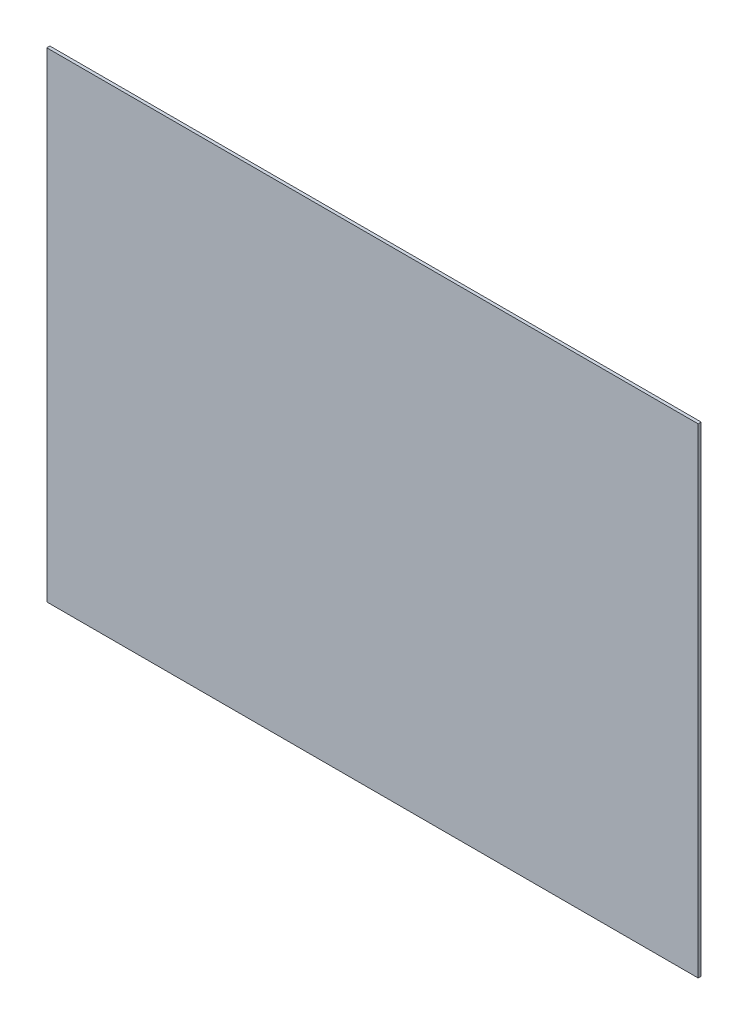
from build123d import *

# Parameters (mm, degrees)
SKETCH_1_W      = 3800
SKETCH_1_H      = 2800
EXTRUDE_1_DEPTH = 18


with BuildPart() as part:
    # Эскиз1 → Бобышка-Вытянуть1 (new body)
    with BuildSketch(Plane.XY):
        Rectangle(SKETCH_1_W, SKETCH_1_H)
    extrude(amount=EXTRUDE_1_DEPTH)


solid = part.part
